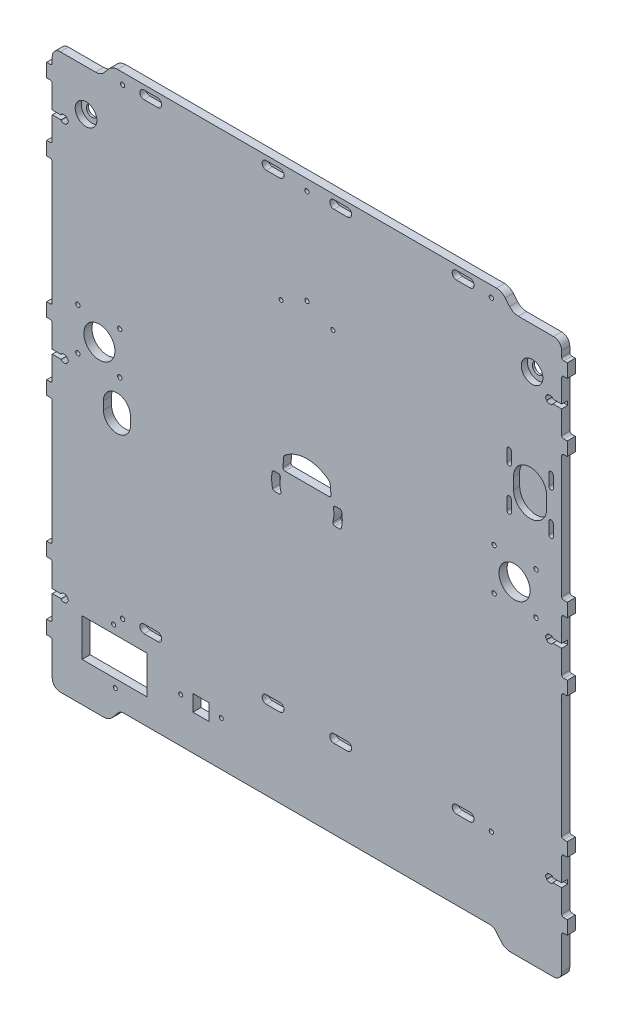
from build123d import *

# Parameters (mm, degrees)
CROQUIS1_R              = 1.6
CROQUIS1_R_2            = 1.5
CROQUIS1_R_3            = 11.5
CROQUIS1_R_4            = 4.25
CROQUIS1_W              = 48
CROQUIS1_H              = 28
CROQUIS1_W_2            = 12
CROQUIS1_H_2            = 12
SALIENTE_EXTRUIR1_DEPTH = 6
CORTAR_EXTRUIR4_START   = -4.5
CROQUIS10_R             = 8
CROQUIS10_R_2           = 4.25
CORTAR_EXTRUIR4_DEPTH   = 4.5
CHAFL_N1_SIZE           = 1.5
CROQUIS11_R             = 1.500000001
CROQUIS11_R_2           = 1.6
CORTAR_EXTRUIR5_DEPTH   = 6


with BuildPart() as part:
    # Croquis1 → Saliente-Extruir1 (new body)
    with BuildSketch(Plane.XY):
        with BuildLine():
            Line((-222.95465507, 205.76041627), (-222.95465507, 168.86041627))
            ThreePointArc((-222.95465507, 168.86041627), (-223.408639559, 167.764400759), (-224.50465507, 167.31041627))
            Line((-224.50465507, 167.31041627), (-227.10465507, 167.31041627))
            Line((-227.10465507, 167.31041627), (-227.10465507, 157.31041627))
            Line((-227.10465507, 157.31041627), (-224.50465507, 157.31041627))
            ThreePointArc((-224.50465507, 157.31041627), (-223.408639559, 156.856431781), (-222.95465507, 155.76041627))
            Line((-222.95465507, 155.76041627), (-222.95465507, 65.56041627))
            ThreePointArc((-222.95465507, 65.56041627), (-223.408639559, 64.464400759), (-224.50465507, 64.01041627))
            Line((-224.50465507, 64.01041627), (-227.10465507, 64.01041627))
            Line((-227.10465507, 64.01041627), (-227.10465507, 54.01041627))
            Line((-227.10465507, 54.01041627), (-224.50465507, 54.01041627))
            ThreePointArc((-224.50465507, 54.01041627), (-223.408639559, 53.556431781), (-222.95465507, 52.46041627))
            Line((-222.95465507, 52.46041627), (-222.95465507, 15.56041627))
            ThreePointArc((-222.95465507, 15.56041627), (-223.408639559, 14.464400759), (-224.50465507, 14.01041627))
            Line((-224.50465507, 14.01041627), (-227.10465507, 14.01041627))
            Line((-227.10465507, 14.01041627), (-227.10465507, 4.01041627))
            Line((-227.10465507, 4.01041627), (-224.50465507, 4.01041627))
            ThreePointArc((-224.50465507, 4.01041627), (-223.408639559, 3.556431781), (-222.95465507, 2.461099925))
            Line((-222.95465507, 2.461099925), (-222.95465507, -87.73958373))
            ThreePointArc((-222.95465507, -87.73958373), (-223.408639559, -88.835599241), (-224.50465507, -89.28958373))
            Line((-224.50465507, -89.28958373), (-227.10465507, -89.28958373))
            Line((-227.10465507, -89.28958373), (-227.10465507, -99.28958373))
            Line((-227.10465507, -99.28958373), (-224.50465507, -99.28958373))
            ThreePointArc((-224.50465507, -99.28958373), (-223.408639559, -99.743568219), (-222.95465507, -100.83958373))
            Line((-222.95465507, -100.83958373), (-222.95465507, -137.73958373))
            ThreePointArc((-222.95465507, -137.73958373), (-223.408639559, -138.835599241), (-224.50465507, -139.28958373))
            Line((-224.50465507, -139.28958373), (-227.10465507, -139.28958373))
            Line((-227.10465507, -139.28958373), (-227.10465507, -149.28958373))
            Line((-227.10465507, -149.28958373), (-224.50465507, -149.28958373))
            ThreePointArc((-224.50465507, -149.28958373), (-223.408639559, -149.743568219), (-222.95465507, -150.83958373))
            Line((-222.95465507, -150.83958373), (-222.95465507, -174.98958373))
            ThreePointArc((-222.95465507, -174.98958373), (-221.197295757, -179.232224417), (-216.95465507, -180.98958373))
            Line((-216.95465507, -180.98958373), (-184.95465507, -180.98958373))
            ThreePointArc((-184.95465507, -180.98958373), (-181.362399845, -180.19319992), (-178.443277303, -177.953278412))
            Line((-178.443277303, -177.953278412), (-174.251121407, -172.957261563))
            ThreePointArc((-174.251121407, -172.957261563), (-172.359383879, -171.505680303), (-170.031422678, -170.98958373))
            Line((-170.031422678, -170.98958373), (100.822112538, -170.98958373))
            ThreePointArc((100.822112538, -170.98958373), (103.15007374, -171.505680303), (105.041811268, -172.957261563))
            Line((105.041811268, -172.957261563), (109.233967164, -177.953278412))
            ThreePointArc((109.233967164, -177.953278412), (112.153089706, -180.19319992), (115.74534493, -180.98958373))
            Line((115.74534493, -180.98958373), (147.74534493, -180.98958373))
            ThreePointArc((147.74534493, -180.98958373), (151.987985617, -179.232224417), (153.74534493, -174.98958373))
            Line((153.74534493, -174.98958373), (153.74534493, -150.83958373))
            ThreePointArc((153.74534493, -150.83958373), (154.19932942, -149.743568219), (155.29534493, -149.28958373))
            Line((155.29534493, -149.28958373), (157.89534493, -149.28958373))
            Line((157.89534493, -149.28958373), (157.89534493, -139.28958373))
            Line((157.89534493, -139.28958373), (155.29534493, -139.28958373))
            ThreePointArc((155.29534493, -139.28958373), (154.19932942, -138.835599241), (153.74534493, -137.73958373))
            Line((153.74534493, -137.73958373), (153.74534493, -100.83958373))
            ThreePointArc((153.74534493, -100.83958373), (154.19932942, -99.743568219), (155.29534493, -99.28958373))
            Line((155.29534493, -99.28958373), (157.89534493, -99.28958373))
            Line((157.89534493, -99.28958373), (157.89534493, -89.28958373))
            Line((157.89534493, -89.28958373), (155.29534493, -89.28958373))
            ThreePointArc((155.29534493, -89.28958373), (154.19932942, -88.835599241), (153.74534493, -87.73958373))
            Line((153.74534493, -87.73958373), (153.74534493, 2.461099925))
            ThreePointArc((153.74534493, 2.461099925), (154.19932942, 3.556431781), (155.29534493, 4.01041627))
            Line((155.29534493, 4.01041627), (157.89534493, 4.01041627))
            Line((157.89534493, 4.01041627), (157.89534493, 14.01041627))
            Line((157.89534493, 14.01041627), (155.29534493, 14.01041627))
            ThreePointArc((155.29534493, 14.01041627), (154.19932942, 14.464400759), (153.74534493, 15.56041627))
            Line((153.74534493, 15.56041627), (153.74534493, 52.46041627))
            ThreePointArc((153.74534493, 52.46041627), (154.19932942, 53.556431781), (155.29534493, 54.01041627))
            Line((155.29534493, 54.01041627), (157.89534493, 54.01041627))
            Line((157.89534493, 54.01041627), (157.89534493, 64.01041627))
            Line((157.89534493, 64.01041627), (155.29534493, 64.01041627))
            ThreePointArc((155.29534493, 64.01041627), (154.19932942, 64.464400759), (153.74534493, 65.56041627))
            Line((153.74534493, 65.56041627), (153.74534493, 155.76041627))
            ThreePointArc((153.74534493, 155.76041627), (154.19932942, 156.856431781), (155.29534493, 157.31041627))
            Line((155.29534493, 157.31041627), (157.89534493, 157.31041627))
            Line((157.89534493, 157.31041627), (157.89534493, 167.31041627))
            Line((157.89534493, 167.31041627), (155.29534493, 167.31041627))
            ThreePointArc((155.29534493, 167.31041627), (154.19932942, 167.764400759), (153.74534493, 168.86041627))
            Line((153.74534493, 168.86041627), (153.74534493, 205.76041627))
            ThreePointArc((153.74534493, 205.76041627), (154.19932942, 206.856431781), (155.29534493, 207.31041627))
            Line((155.29534493, 207.31041627), (157.89534493, 207.31041627))
            Line((157.89534493, 207.31041627), (157.89534493, 217.31041627))
            Line((157.89534493, 217.31041627), (155.29534493, 217.31041627))
            ThreePointArc((155.29534493, 217.31041627), (154.19932942, 217.764400759), (153.74534493, 218.86041627))
            Line((153.74534493, 218.86041627), (153.74534493, 223.11041627))
            ThreePointArc((153.74534493, 223.11041627), (151.987985617, 227.353056957), (147.74534493, 229.11041627))
            Line((147.74534493, 229.11041627), (121.74534493, 229.11041627))
            ThreePointArc((121.74534493, 229.11041627), (118.153089706, 229.90680008), (115.233967164, 232.146721588))
            Line((115.233967164, 232.146721588), (112.02240616, 235.974110952))
            ThreePointArc((112.02240616, 235.974110952), (109.103283618, 238.21403246), (105.511028393, 239.01041627))
            Line((105.511028393, 239.01041627), (-174.720338532, 239.01041627))
            ThreePointArc((-174.720338532, 239.01041627), (-178.312593757, 238.21403246), (-181.231716299, 235.974110952))
            Line((-181.231716299, 235.974110952), (-184.443277303, 232.146721588))
            ThreePointArc((-184.443277303, 232.146721588), (-187.362399845, 229.90680008), (-190.95465507, 229.11041627))
            Line((-190.95465507, 229.11041627), (-216.95465507, 229.11041627))
            ThreePointArc((-216.95465507, 229.11041627), (-221.197295757, 227.353056957), (-222.95465507, 223.11041627))
            Line((-222.95465507, 223.11041627), (-222.95465507, 218.86041627))
            ThreePointArc((-222.95465507, 218.86041627), (-223.408639559, 217.764400759), (-224.50465507, 217.31041627))
            Line((-224.50465507, 217.31041627), (-227.10465507, 217.31041627))
            Line((-227.10465507, 217.31041627), (-227.10465507, 207.31041627))
            Line((-227.10465507, 207.31041627), (-224.50465507, 207.31041627))
            ThreePointArc((-224.50465507, 207.31041627), (-223.408639559, 206.856431781), (-222.95465507, 205.76041627))
        make_face()
        with Locations((101.74534493, 231.01041627)):
            Circle(CROQUIS1_R, mode=Mode.SUBTRACT)
        with Locations((-34.60465507, 231.01041627)):
            Circle(CROQUIS1_R, mode=Mode.SUBTRACT)
        with Locations((101.74534493, -110.98958373)):
            Circle(CROQUIS1_R, mode=Mode.SUBTRACT)
        with Locations((-177.55465507, -117.98958373)):
            Circle(CROQUIS1_R_2, mode=Mode.SUBTRACT)
        with Locations((-176.35465507, -157.98958373)):
            Circle(CROQUIS1_R_2, mode=Mode.SUBTRACT)
        with Locations((-188.10465507, 57.61041627)):
            Circle(CROQUIS1_R_3, mode=Mode.SUBTRACT)
        with Locations((-204.028904264, 73.61041627)):
            Circle(CROQUIS1_R, mode=Mode.SUBTRACT)
        with Locations((-173.028904264, 73.61041627)):
            Circle(CROQUIS1_R, mode=Mode.SUBTRACT)
        with Locations((-204.028904264, 42.61041627)):
            Circle(CROQUIS1_R, mode=Mode.SUBTRACT)
        with Locations((-173.028904264, 42.61041627)):
            Circle(CROQUIS1_R, mode=Mode.SUBTRACT)
        with Locations((-127.95465507, -137.98958373)):
            Circle(CROQUIS1_R_2, mode=Mode.SUBTRACT)
        with Locations((-197.95465507, 198.61041627)):
            Circle(CROQUIS1_R_4, mode=Mode.SUBTRACT)
        with Locations((-170.95465507, 231.01041627)):
            Circle(CROQUIS1_R, mode=Mode.SUBTRACT)
        with Locations((-97.95465507, -137.98958373)):
            Circle(CROQUIS1_R_2, mode=Mode.SUBTRACT)
        with Locations((103.819594125, 42.61041627)):
            Circle(CROQUIS1_R, mode=Mode.SUBTRACT)
        with Locations((134.819594125, 42.61041627)):
            Circle(CROQUIS1_R, mode=Mode.SUBTRACT)
        with Locations((103.819594125, 73.61041627)):
            Circle(CROQUIS1_R, mode=Mode.SUBTRACT)
        with Locations((131.89534493, 198.61041627)):
            Circle(CROQUIS1_R_4, mode=Mode.SUBTRACT)
        with Locations((134.819594125, 73.61041627)):
            Circle(CROQUIS1_R, mode=Mode.SUBTRACT)
        with Locations((118.89534493, 57.61041627)):
            Circle(CROQUIS1_R_3, mode=Mode.SUBTRACT)
        with Locations((-170.95465507, -110.98958373)):
            Circle(CROQUIS1_R, mode=Mode.SUBTRACT)
        with BuildLine():
            Line((-10.679520234, 26.776689028), (-13.879047758, 26.776689029))
            ThreePointArc((-13.879047758, 26.776689029), (-15.111568899, 27.386745082), (-15.373940312, 28.736722116))
            ThreePointArc((-15.373940312, 28.736722116), (-14.67762389, 33.27172253), (-15.036266273, 37.845830196))
            ThreePointArc((-15.036266273, 37.845830196), (-14.711977039, 39.129015944), (-13.51512475, 39.694059098))
            Line((-13.51512475, 39.694059098), (-10.363583155, 39.694059098))
            ThreePointArc((-10.363583155, 39.694059098), (-9.363864345, 39.328594449), (-8.835554553, 38.40453229))
            ThreePointArc((-8.835554553, 38.40453229), (-8.47712568, 33.169580365), (-9.171406629, 27.968506737))
            ThreePointArc((-9.171406629, 27.968506737), (-9.718422412, 27.110610351), (-10.679520234, 26.776689028))
        make_face(mode=Mode.SUBTRACT)
        with BuildLine():
            Line((-16.82698114, 45.302421524), (-17.454641005, 52.476606606))
            ThreePointArc((-17.454641005, 52.476606606), (-17.621340665, 53.052347784), (-17.994005363, 53.521802473))
            ThreePointArc((-17.994005363, 53.521802473), (-34.60465507, 59.634777242), (-51.215304777, 53.521802473))
            ThreePointArc((-51.215304777, 53.521802473), (-51.587969474, 53.052347784), (-51.754669134, 52.476606606))
            Line((-51.754669134, 52.476606606), (-52.382328999, 45.302421524))
            ThreePointArc((-52.382328999, 45.302421524), (-51.980985234, 44.120100919), (-50.83814313, 43.617238358))
            Line((-50.83814313, 43.617238358), (-18.371167009, 43.617238358))
            ThreePointArc((-18.371167009, 43.617238358), (-17.228324905, 44.120100919), (-16.82698114, 45.302421524))
        make_face(mode=Mode.SUBTRACT)
        with BuildLine():
            Line((-58.529789905, 26.776689028), (-55.330262382, 26.776689029))
            ThreePointArc((-55.330262382, 26.776689029), (-54.09774124, 27.386745082), (-53.835369827, 28.736722116))
            ThreePointArc((-53.835369827, 28.736722116), (-54.53168625, 33.27172253), (-54.173043867, 37.845830196))
            ThreePointArc((-54.173043867, 37.845830196), (-54.4973331, 39.129015944), (-55.694185389, 39.694059098))
            Line((-55.694185389, 39.694059098), (-58.845726984, 39.694059098))
            ThreePointArc((-58.845726984, 39.694059098), (-59.845445795, 39.328594449), (-60.373755586, 38.40453229))
            ThreePointArc((-60.373755586, 38.40453229), (-60.73218446, 33.169580365), (-60.03790351, 27.968506737))
            ThreePointArc((-60.03790351, 27.968506737), (-59.490887728, 27.110610351), (-58.529789905, 26.776689028))
        make_face(mode=Mode.SUBTRACT)
        with BuildLine():
            Line((-185.10465507, 15.61041627), (-185.10465507, 21.61041627))
            ThreePointArc((-185.10465507, 21.61041627), (-175.10465507, 31.61041627), (-165.10465507, 21.61041627))
            Line((-165.10465507, 21.61041627), (-165.10465507, 15.61041627))
            ThreePointArc((-165.10465507, 15.61041627), (-175.10465507, 5.61041627), (-185.10465507, 15.61041627))
        make_face(mode=Mode.SUBTRACT)
        with Locations((-176.95465507, -137.98958373)):
            Rectangle(CROQUIS1_W, CROQUIS1_H, mode=Mode.SUBTRACT)
        with BuildLine():
            Line((113.242523558, 131.610299192), (113.241921566, 140.11029917))
            ThreePointArc((113.241921566, 140.11029917), (114.895227831, 141.763839634), (116.548768295, 140.11053337))
            Line((116.548768295, 140.11053337), (116.549370286, 131.610533391))
            ThreePointArc((116.549370286, 131.610533391), (114.896064022, 129.956992927), (113.242523558, 131.610299192))
        make_face(mode=Mode.SUBTRACT)
        with BuildLine():
            Line((144.242523558, 131.610299192), (144.241921566, 140.11029917))
            ThreePointArc((144.241921566, 140.11029917), (145.895227831, 141.763839634), (147.548768295, 140.11053337))
            Line((147.548768295, 140.11053337), (147.549370286, 131.610533391))
            ThreePointArc((147.549370286, 131.610533391), (145.896064022, 129.956992927), (144.242523558, 131.610299192))
        make_face(mode=Mode.SUBTRACT)
        with BuildLine():
            Line((113.242523558, 100.610299221), (113.241921566, 109.1102992))
            ThreePointArc((113.241921566, 109.1102992), (114.895227831, 110.763839663), (116.548768295, 109.110533399))
            Line((116.548768295, 109.110533399), (116.549370286, 100.61053342))
            ThreePointArc((116.549370286, 100.61053342), (114.896064022, 98.956992956), (113.242523558, 100.610299221))
        make_face(mode=Mode.SUBTRACT)
        with BuildLine():
            Line((144.242523558, 100.610299221), (144.241921566, 109.1102992))
            ThreePointArc((144.241921566, 109.1102992), (145.895227831, 110.763839663), (147.548768295, 109.110533399))
            Line((147.548768295, 109.110533399), (147.549370286, 100.61053342))
            ThreePointArc((147.549370286, 100.61053342), (145.896064022, 98.956992956), (144.242523558, 100.610299221))
        make_face(mode=Mode.SUBTRACT)
        with Locations((-112.95465507, -138.821397395)):
            Rectangle(CROQUIS1_W_2, CROQUIS1_H_2, mode=Mode.SUBTRACT)
    extrude(amount=SALIENTE_EXTRUIR1_DEPTH)

    # Croquis10 → Cortar-Extruir4 (cut)
    # profile 1 of 17: a face of its own
    with BuildSketch(Plane.XY.offset(6).offset(CORTAR_EXTRUIR4_START)):
        with Locations((-197.95465507, 198.61041627)):
            Circle(CROQUIS10_R)
    # profile 2 of 17: a face of its own
    with BuildSketch(Plane.XY.offset(6).offset(CORTAR_EXTRUIR4_START)):
        with Locations((131.89534493, 198.61041627)):
            Circle(CROQUIS10_R)
        with Locations((131.89534493, 198.61041627)):
            Circle(CROQUIS10_R_2, mode=Mode.SUBTRACT)
    # profile 3 of 17: a face of its own
    with BuildSketch(Plane.XY.offset(6).offset(CORTAR_EXTRUIR4_START)):
        with BuildLine():
            Line((142.672030658, 116.161086189), (142.672030658, 124.610416255))
            ThreePointArc((142.672030658, 124.610416255), (130.324024601, 136.886894817), (118.119487861, 124.467778003))
            Line((118.119487861, 124.467778003), (118.217657489, 116.019018255))
            ThreePointArc((118.217657489, 116.019018255), (130.515466567, 103.93369327), (142.672030658, 116.161086189))
        make_face()
    # profile 4 of 17: a face of its own
    with BuildSketch(Plane.XY.offset(6).offset(CORTAR_EXTRUIR4_START)):
        with BuildLine():
            Line((-216.454429827, 188.86041627), (-222.95465507, 188.86041627))
            Line((-222.95465507, 188.86041627), (-222.95465507, 185.76041627))
            Line((-222.95465507, 185.76041627), (-216.454429827, 185.76041627))
            ThreePointArc((-216.454429827, 185.76041627), (-215.908828016, 184.89695016), (-214.94446294, 184.56041627))
            Line((-214.94446294, 184.56041627), (-213.39446294, 184.56041627))
            ThreePointArc((-213.39446294, 184.56041627), (-212.424527577, 184.901397911), (-211.881340797, 185.77431899))
            Line((-211.881340797, 185.77431899), (-211.881340797, 185.943563923))
            ThreePointArc((-211.881340797, 185.943563923), (-211.062022675, 187.31041627), (-211.881340797, 188.677268617))
            Line((-211.881340797, 188.677268617), (-211.881340797, 188.84651355))
            ThreePointArc((-211.881340797, 188.84651355), (-212.424527577, 189.719434629), (-213.39446294, 190.06041627))
            Line((-213.39446294, 190.06041627), (-214.94446294, 190.06041627))
            ThreePointArc((-214.94446294, 190.06041627), (-215.908828016, 189.72388238), (-216.454429827, 188.86041627))
        make_face()
    # profile 5 of 17: a face of its own
    with BuildSketch(Plane.XY.offset(6).offset(CORTAR_EXTRUIR4_START)):
        with BuildLine():
            Line((-216.454429827, 35.56041627), (-222.95465507, 35.56041627))
            Line((-222.95465507, 35.56041627), (-222.95465507, 32.46041627))
            Line((-222.95465507, 32.46041627), (-216.454429827, 32.46041627))
            ThreePointArc((-216.454429827, 32.46041627), (-215.908828016, 31.59695016), (-214.94446294, 31.26041627))
            Line((-214.94446294, 31.26041627), (-213.39446294, 31.26041627))
            ThreePointArc((-213.39446294, 31.26041627), (-212.424527577, 31.601397911), (-211.881340797, 32.47431899))
            Line((-211.881340797, 32.47431899), (-211.881340797, 32.643563923))
            ThreePointArc((-211.881340797, 32.643563923), (-211.062022675, 34.01041627), (-211.881340797, 35.377268617))
            Line((-211.881340797, 35.377268617), (-211.881340797, 35.54651355))
            ThreePointArc((-211.881340797, 35.54651355), (-212.424527577, 36.419434629), (-213.39446294, 36.76041627))
            Line((-213.39446294, 36.76041627), (-214.94446294, 36.76041627))
            ThreePointArc((-214.94446294, 36.76041627), (-215.908828016, 36.42388238), (-216.454429827, 35.56041627))
        make_face()
    # profile 6 of 17: a face of its own
    with BuildSketch(Plane.XY.offset(6).offset(CORTAR_EXTRUIR4_START)):
        with BuildLine():
            Line((-216.454429827, -117.73958373), (-222.95465507, -117.73958373))
            Line((-222.95465507, -117.73958373), (-222.95465507, -120.83958373))
            Line((-222.95465507, -120.83958373), (-216.454429827, -120.83958373))
            ThreePointArc((-216.454429827, -120.83958373), (-215.908828016, -121.70304984), (-214.94446294, -122.03958373))
            Line((-214.94446294, -122.03958373), (-213.39446294, -122.03958373))
            ThreePointArc((-213.39446294, -122.03958373), (-212.424527577, -121.698602089), (-211.881340797, -120.82568101))
            Line((-211.881340797, -120.82568101), (-211.881340797, -120.656436077))
            ThreePointArc((-211.881340797, -120.656436077), (-211.062022675, -119.28958373), (-211.881340797, -117.922731383))
            Line((-211.881340797, -117.922731383), (-211.881340797, -117.75348645))
            ThreePointArc((-211.881340797, -117.75348645), (-212.424527577, -116.880565371), (-213.39446294, -116.53958373))
            Line((-213.39446294, -116.53958373), (-214.94446294, -116.53958373))
            ThreePointArc((-214.94446294, -116.53958373), (-215.908828016, -116.87611762), (-216.454429827, -117.73958373))
        make_face()
    # profile 7 of 17: a face of its own
    with BuildSketch(Plane.XY.offset(6).offset(CORTAR_EXTRUIR4_START)):
        with BuildLine():
            Line((147.245119688, -120.83958373), (153.74534493, -120.83958373))
            Line((153.74534493, -120.83958373), (153.74534493, -117.73958373))
            Line((153.74534493, -117.73958373), (147.245119688, -117.73958373))
            ThreePointArc((147.245119688, -117.73958373), (146.699517877, -116.87611762), (145.735152801, -116.53958373))
            Line((145.735152801, -116.53958373), (144.185152801, -116.53958373))
            ThreePointArc((144.185152801, -116.53958373), (143.215217438, -116.880565371), (142.672030658, -117.75348645))
            Line((142.672030658, -117.75348645), (142.672030658, -117.922731383))
            ThreePointArc((142.672030658, -117.922731383), (141.852712535, -119.28958373), (142.672030658, -120.656436077))
            Line((142.672030658, -120.656436077), (142.672030658, -120.82568101))
            ThreePointArc((142.672030658, -120.82568101), (143.215217438, -121.698602089), (144.185152801, -122.03958373))
            Line((144.185152801, -122.03958373), (145.735152801, -122.03958373))
            ThreePointArc((145.735152801, -122.03958373), (146.699517877, -121.70304984), (147.245119688, -120.83958373))
        make_face()
    # profile 8 of 17: a face of its own
    with BuildSketch(Plane.XY.offset(6).offset(CORTAR_EXTRUIR4_START)):
        with BuildLine():
            Line((147.245119688, 32.46041627), (153.74534493, 32.46041627))
            Line((153.74534493, 32.46041627), (153.74534493, 35.56041627))
            Line((153.74534493, 35.56041627), (147.245119688, 35.56041627))
            ThreePointArc((147.245119688, 35.56041627), (146.699517877, 36.42388238), (145.735152801, 36.76041627))
            Line((145.735152801, 36.76041627), (144.185152801, 36.76041627))
            ThreePointArc((144.185152801, 36.76041627), (143.215217438, 36.419434629), (142.672030658, 35.54651355))
            Line((142.672030658, 35.54651355), (142.672030658, 35.377268617))
            ThreePointArc((142.672030658, 35.377268617), (141.852712535, 34.01041627), (142.672030658, 32.643563923))
            Line((142.672030658, 32.643563923), (142.672030658, 32.47431899))
            ThreePointArc((142.672030658, 32.47431899), (143.215217438, 31.601397911), (144.185152801, 31.26041627))
            Line((144.185152801, 31.26041627), (145.735152801, 31.26041627))
            ThreePointArc((145.735152801, 31.26041627), (146.699517877, 31.59695016), (147.245119688, 32.46041627))
        make_face()
    # profile 9 of 17: a face of its own
    with BuildSketch(Plane.XY.offset(6).offset(CORTAR_EXTRUIR4_START)):
        with BuildLine():
            Line((147.245119688, 185.76041627), (153.74534493, 185.76041627))
            Line((153.74534493, 185.76041627), (153.74534493, 188.86041627))
            Line((153.74534493, 188.86041627), (147.245119688, 188.86041627))
            ThreePointArc((147.245119688, 188.86041627), (146.699517877, 189.72388238), (145.735152801, 190.06041627))
            Line((145.735152801, 190.06041627), (144.185152801, 190.06041627))
            ThreePointArc((144.185152801, 190.06041627), (143.215217438, 189.719434629), (142.672030658, 188.84651355))
            Line((142.672030658, 188.84651355), (142.672030658, 188.677268617))
            ThreePointArc((142.672030658, 188.677268617), (141.852712535, 187.31041627), (142.672030658, 185.943563923))
            Line((142.672030658, 185.943563923), (142.672030658, 185.77431899))
            ThreePointArc((142.672030658, 185.77431899), (143.215217438, 184.901397911), (144.185152801, 184.56041627))
            Line((144.185152801, 184.56041627), (145.735152801, 184.56041627))
            ThreePointArc((145.735152801, 184.56041627), (146.699517877, 184.89695016), (147.245119688, 185.76041627))
        make_face()
    # profile 10 of 17: a face of its own
    with BuildSketch(Plane.XY.offset(6).offset(CORTAR_EXTRUIR4_START)):
        with BuildLine():
            Line((-64.60465507, 235.61041627), (-54.60465507, 235.61041627))
            ThreePointArc((-54.60465507, 235.61041627), (-51.50465507, 232.51041627), (-54.60465507, 229.41041627))
            Line((-54.60465507, 229.41041627), (-64.60465507, 229.41041627))
            ThreePointArc((-64.60465507, 229.41041627), (-67.70465507, 232.51041627), (-64.60465507, 235.61041627))
        make_face()
    # profile 11 of 17: a face of its own
    with BuildSketch(Plane.XY.offset(6).offset(CORTAR_EXTRUIR4_START)):
        with BuildLine():
            Line((-155.10465507, 235.61041627), (-145.10465507, 235.61041627))
            ThreePointArc((-145.10465507, 235.61041627), (-142.00465507, 232.51041627), (-145.10465507, 229.41041627))
            Line((-145.10465507, 229.41041627), (-155.10465507, 229.41041627))
            ThreePointArc((-155.10465507, 229.41041627), (-158.20465507, 232.51041627), (-155.10465507, 235.61041627))
        make_face()
    # profile 12 of 17: a face of its own
    with BuildSketch(Plane.XY.offset(6).offset(CORTAR_EXTRUIR4_START)):
        with BuildLine():
            Line((-4.60465507, 229.41041627), (-14.60465507, 229.41041627))
            ThreePointArc((-14.60465507, 229.41041627), (-17.70465507, 232.51041627), (-14.60465507, 235.61041627))
            Line((-14.60465507, 235.61041627), (-4.60465507, 235.61041627))
            ThreePointArc((-4.60465507, 235.61041627), (-1.50465507, 232.51041627), (-4.60465507, 229.41041627))
        make_face()
    # profile 13 of 17: a face of its own
    with BuildSketch(Plane.XY.offset(6).offset(CORTAR_EXTRUIR4_START)):
        with BuildLine():
            Line((85.89534493, 235.61041627), (75.89534493, 235.61041627))
            ThreePointArc((75.89534493, 235.61041627), (72.79534493, 232.51041627), (75.89534493, 229.41041627))
            Line((75.89534493, 229.41041627), (85.89534493, 229.41041627))
            ThreePointArc((85.89534493, 229.41041627), (88.99534493, 232.51041627), (85.89534493, 235.61041627))
        make_face()
    # profile 14 of 17: a face of its own
    with BuildSketch(Plane.XY.offset(6).offset(CORTAR_EXTRUIR4_START)):
        with BuildLine():
            Line((-64.60465507, -112.58958373), (-54.60465507, -112.58958373))
            ThreePointArc((-54.60465507, -112.58958373), (-51.50465507, -109.48958373), (-54.60465507, -106.38958373))
            Line((-54.60465507, -106.38958373), (-64.60465507, -106.38958373))
            ThreePointArc((-64.60465507, -106.38958373), (-67.70465507, -109.48958373), (-64.60465507, -112.58958373))
        make_face()
    # profile 15 of 17: a face of its own
    with BuildSketch(Plane.XY.offset(6).offset(CORTAR_EXTRUIR4_START)):
        with BuildLine():
            Line((-155.10465507, -106.38958373), (-145.10465507, -106.38958373))
            ThreePointArc((-145.10465507, -106.38958373), (-142.00465507, -109.48958373), (-145.10465507, -112.58958373))
            Line((-145.10465507, -112.58958373), (-155.10465507, -112.58958373))
            ThreePointArc((-155.10465507, -112.58958373), (-158.20465507, -109.48958373), (-155.10465507, -106.38958373))
        make_face()
    # profile 16 of 17: a face of its own
    with BuildSketch(Plane.XY.offset(6).offset(CORTAR_EXTRUIR4_START)):
        with BuildLine():
            Line((-4.60465507, -112.58958373), (-14.60465507, -112.58958373))
            ThreePointArc((-14.60465507, -112.58958373), (-17.70465507, -109.48958373), (-14.60465507, -106.38958373))
            Line((-14.60465507, -106.38958373), (-4.60465507, -106.38958373))
            ThreePointArc((-4.60465507, -106.38958373), (-1.50465507, -109.48958373), (-4.60465507, -112.58958373))
        make_face()
    # profile 17 of 17: a face of its own
    with BuildSketch(Plane.XY.offset(6).offset(CORTAR_EXTRUIR4_START)):
        with BuildLine():
            Line((85.89534493, -106.38958373), (75.89534493, -106.38958373))
            ThreePointArc((75.89534493, -106.38958373), (72.79534493, -109.48958373), (75.89534493, -112.58958373))
            Line((75.89534493, -112.58958373), (85.89534493, -112.58958373))
            ThreePointArc((85.89534493, -112.58958373), (88.99534493, -109.48958373), (85.89534493, -106.38958373))
        make_face()
    extrude(amount=CORTAR_EXTRUIR4_DEPTH, mode=Mode.SUBTRACT)

    # Chaflán1
    chafl_n1_edges = [part.edges().sort_by_distance(p)[0] for p in [
        (102.219594125, 73.61041627, 0),
        (102.219594125, 42.61041627, 0),
        (-99.45465507, -137.98958373, 0),
        (-172.55465507, 231.01041627, 0),
        (-129.45465507, -137.98958373, 0),
        (-174.628904264, 42.61041627, 0),
        (-205.628904264, 42.61041627, 0),
        (-174.628904264, 73.61041627, 0),
        (-205.628904264, 73.61041627, 0),
        (-177.85465507, -157.98958373, 0),
        (-179.05465507, -117.98958373, 0),
        (100.14534493, 231.01041627, 0),
        (-36.20465507, 231.01041627, 0),
        (100.14534493, -110.98958373, 0),
        (133.219594125, 42.61041627, 0),
        (133.219594125, 73.61041627, 0),
        (-172.55465507, -110.98958373, 0),
    ]]
    chamfer(chafl_n1_edges, length=CHAFL_N1_SIZE)

    # Croquis11 → Cortar-Extruir5 (cut)
    with BuildSketch(Plane.XY.offset(6)):
        with Locations((-53.78465507, 151.763839634)):
            Circle(CROQUIS11_R)
        with Locations((-15.42465507, 151.763839634)):
            Circle(CROQUIS11_R)
        with Locations((-34.60465507, 160.763839634)):
            Circle(CROQUIS11_R_2)
    extrude(amount=-CORTAR_EXTRUIR5_DEPTH, mode=Mode.SUBTRACT)


solid = part.part
